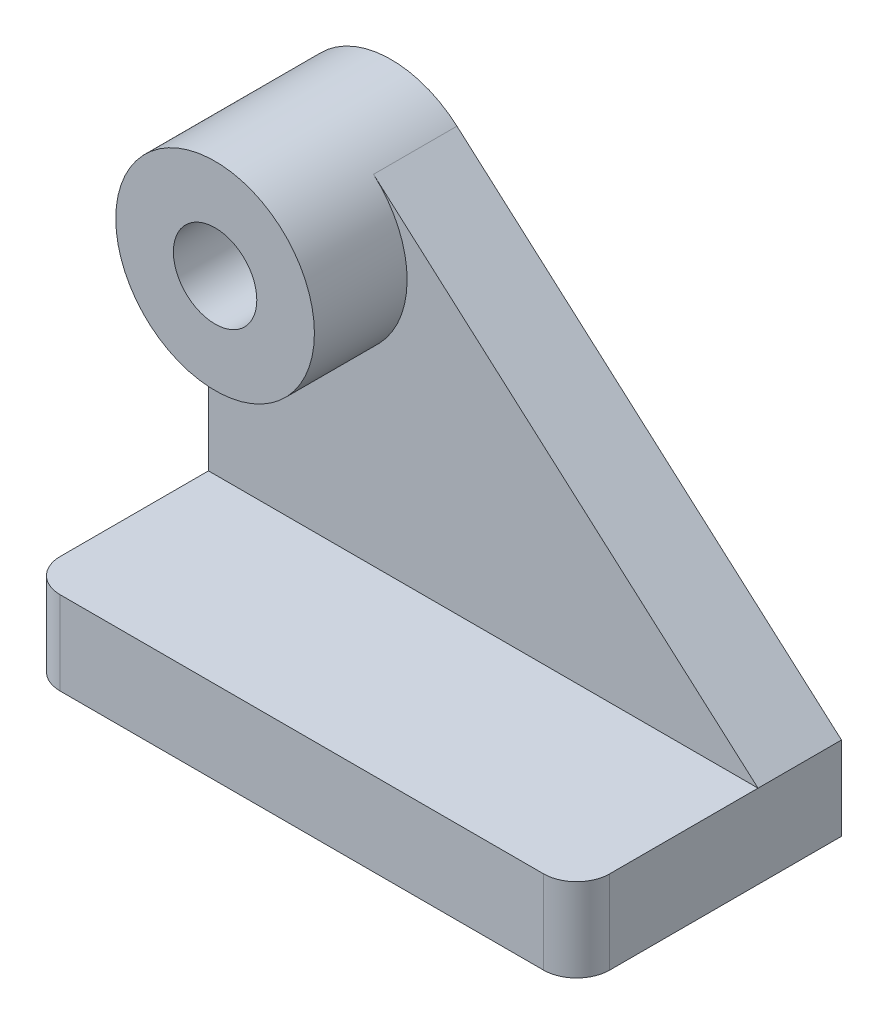
from build123d import *

# Parameters (mm, degrees)
SALIENTE_EXTRUIR1_DEPTH = 0.63
CROQUIS2_R              = 0.315
SALIENTE_EXTRUIR2_DEPTH = 0.63
CROQUIS3_R              = 0.315
SALIENTE_EXTRUIR3_DEPTH = 0.7


with BuildPart() as part:
    # Croquis1 → Saliente-Extruir1 (new body)
    with BuildSketch(Plane(origin=(0, 0, 0), x_dir=(1, 0, 0), z_dir=(0, 1, 0))):
        with BuildLine():
            Line((-2.01076716, 1.122678331), (2.13923284, 1.122678331))
            Line((2.13923284, 1.122678331), (2.13923284, -0.627321669))
            ThreePointArc((2.13923284, -0.627321669), (2.066009535, -0.804098364), (1.88923284, -0.877321669))
            Line((1.88923284, -0.877321669), (-1.76076716, -0.877321669))
            ThreePointArc((-1.76076716, -0.877321669), (-1.937543855, -0.804098364), (-2.01076716, -0.627321669))
            Line((-2.01076716, -0.627321669), (-2.01076716, 1.122678331))
        make_face()
    extrude(amount=SALIENTE_EXTRUIR1_DEPTH)

    # Croquis2 → Saliente-Extruir2 (add)
    with BuildSketch(Plane(origin=(0, 0, -1.122678331), x_dir=(-1, 0, 0), z_dir=(0, 0, -1))):
        with BuildLine():
            Line((-2.13923284, 0.63), (0.764527387, 3.192357615))
            ThreePointArc((0.764527387, 3.192357615), (1.569247443, 3.313622641), (2.01076716, 2.63))
            Line((2.01076716, 2.63), (2.01076716, 0.63))
            Line((2.01076716, 0.63), (-2.13923284, 0.63))
        make_face()
        with Locations((1.26076716, 2.63)):
            Circle(CROQUIS2_R, mode=Mode.SUBTRACT)
    extrude(amount=-SALIENTE_EXTRUIR2_DEPTH)

    # Croquis3 → Saliente-Extruir3 (add)
    with BuildSketch(Plane.XY.offset(-0.492678331)):
        with BuildLine():
            ThreePointArc((-0.764527387, 3.192357615), (-1.569247443, 3.313622641), (-2.01076716, 2.63))
            ThreePointArc((-2.01076716, 2.63), (-1.26076716, 1.88), (-0.51076716, 2.63))
            ThreePointArc((-0.51076716, 2.63), (-0.577144519, 2.938480283), (-0.764527387, 3.192357615))
        make_face()
        with Locations(Location((-1.26076716, 2.63, 0), (0, 0, 180))):
            Circle(CROQUIS3_R, mode=Mode.SUBTRACT)
    extrude(amount=SALIENTE_EXTRUIR3_DEPTH)


solid = part.part
